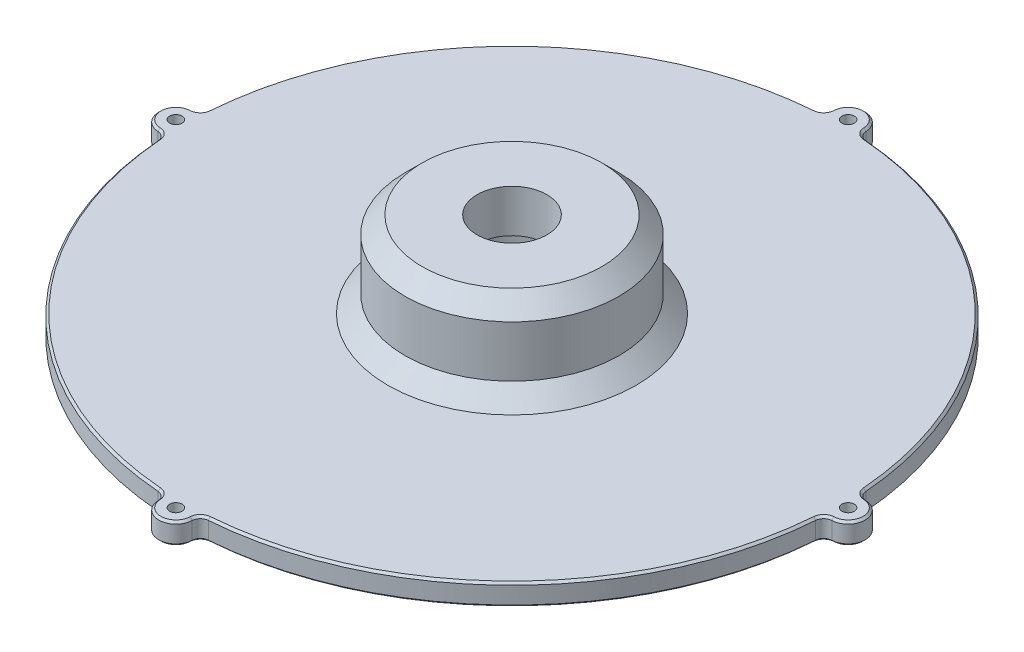
from build123d import *

# Parameters (mm, degrees)
SZKIC2_W                    = 62
SZKIC2_H                    = 5
SZKIC3_R                    = 1.45
DODANIE_WYCI_GNI_CIE1_DEPTH = 5
SFAZOWANIE1_SIZE            = 4
ZAOKR_GLENIE1_R             = 2
SFAZOWANIE2_SIZE            = 0.5


with BuildPart() as part:
    # Szkic2 → Obrót1 (revolve)
    with BuildSketch(Plane.XY, mode=Mode.PRIVATE) as obr_t1_sk:
        Polygon((15, 15), (15, 5), (25, 5), (25, 25), (8.15, 25), (8.15, 15), align=None)
        with Locations((46, 2.5)):
            Rectangle(SZKIC2_W, SZKIC2_H)
    revolve(obr_t1_sk.sketch.rotate(Axis((0, 0, 0), (0, 1, 0)), 90), axis=Axis((0, 0, 0), (0, 1, 0)))

    # Szkic3 → Dodanie-wyciągnięcie1 (add)
    # profile 1 of 4: a face of its own
    with BuildSketch(Plane(origin=(0, 5, 0), x_dir=(1, 0, 0), z_dir=(0, 1, 0))):
        with BuildLine():
            Line((-4, 76), (-4, 78.5))
            ThreePointArc((-4, 78.5), (0, 82.5), (4, 78.5))
            Line((4, 78.5), (4, 76))
            ThreePointArc((4, 76), (0, 72), (-4, 76))
        make_face()
        with Locations(Location((0, 78.5, 0), (0, 0, 270))):
            Circle(SZKIC3_R, mode=Mode.SUBTRACT)
    # profile 2 of 4: a face of its own
    with BuildSketch(Plane(origin=(0, 5, 0), x_dir=(1, 0, 0), z_dir=(0, 1, 0))):
        with BuildLine():
            Line((76, 4), (78.5, 4))
            ThreePointArc((78.5, 4), (82.5, 0), (78.5, -4))
            Line((78.5, -4), (76, -4))
            ThreePointArc((76, -4), (72, 0), (76, 4))
        make_face()
        with Locations(Location((78.5, 0, 0), (0, 0, 270))):
            Circle(SZKIC3_R, mode=Mode.SUBTRACT)
    # profile 3 of 4: a face of its own
    with BuildSketch(Plane(origin=(0, 5, 0), x_dir=(1, 0, 0), z_dir=(0, 1, 0))):
        with BuildLine():
            Line((4, -76), (4, -78.5))
            ThreePointArc((4, -78.5), (0, -82.5), (-4, -78.5))
            Line((-4, -78.5), (-4, -76))
            ThreePointArc((-4, -76), (0, -72), (4, -76))
        make_face()
        with Locations(Location((0, -78.5, 0), (0, 0, 270))):
            Circle(SZKIC3_R, mode=Mode.SUBTRACT)
    # profile 4 of 4: a face of its own
    with BuildSketch(Plane(origin=(0, 5, 0), x_dir=(1, 0, 0), z_dir=(0, 1, 0))):
        with BuildLine():
            Line((-76, -4), (-78.5, -4))
            ThreePointArc((-78.5, -4), (-82.5, 0), (-78.5, 4))
            Line((-78.5, 4), (-76, 4))
            ThreePointArc((-76, 4), (-72, 0), (-76, -4))
        make_face()
        with Locations(Location((-78.5, 0, 0), (0, 0, 270))):
            Circle(SZKIC3_R, mode=Mode.SUBTRACT)
    extrude(amount=-DODANIE_WYCI_GNI_CIE1_DEPTH)

    # Sfazowanie1
    sfazowanie1_edges = [part.edges().sort_by_distance(p)[0] for p in [
        (0, 25, 25),
        (0, 5, 25),
    ]]
    chamfer(sfazowanie1_edges, length=SFAZOWANIE1_SIZE)

    # Zaokrąglenie1
    zaokr_glenie1_edges = [part.edges().sort_by_distance(p)[0] for p in [
        (76.896033708, 2.5, 4),
        (76.896033708, 2.5, -4),
        (4, 2.5, 76.896033708),
        (-4, 2.5, 76.896033708),
        (-76.896033708, 2.5, 4),
        (-76.896033708, 2.5, -4),
        (4, 2.5, -76.896033708),
        (-4, 2.5, -76.896033708),
    ]]
    fillet(zaokr_glenie1_edges, radius=ZAOKR_GLENIE1_R)

    # Sfazowanie2
    sfazowanie2_edges = [part.edges().sort_by_distance(p)[0] for p in [
        (0, 5, -82.5),
        (0, 0, -82.5),
        (77.379843058, 5, 4.55817089),
        (77.379843058, 0, 4.55817089),
        (77.379843058, 5, -4.55817089),
        (77.379843058, 0, -4.55817089),
        (4.55817089, 5, 77.379843058),
        (4.55817089, 0, 77.379843058),
        (-4.55817089, 5, 77.379843058),
        (-4.55817089, 0, 77.379843058),
        (-77.379843058, 5, 4.55817089),
        (-77.379843058, 0, 4.55817089),
        (-77.379843058, 5, -4.55817089),
        (-77.379843058, 0, -4.55817089),
        (4.55817089, 5, -77.379843058),
        (4.55817089, 0, -77.379843058),
        (-4.55817089, 5, -77.379843058),
        (-4.55817089, 0, -77.379843058),
        (-78.5, 0, -1.45),
        (0, 0, 77.05),
        (78.5, 0, -1.45),
        (0, 0, -79.95),
        (0, 0, 15),
        (54.447222151, 5, 54.447222151),
        (54.447222151, 0, 54.447222151),
        (82.5, 5, 0),
        (82.5, 0, 0),
        (54.447222151, 5, -54.447222151),
        (54.447222151, 0, -54.447222151),
        (0, 5, 82.5),
        (0, 0, 82.5),
        (-54.447222151, 5, 54.447222151),
        (-54.447222151, 0, 54.447222151),
        (-82.5, 5, 0),
        (-82.5, 0, 0),
        (-54.447222151, 5, -54.447222151),
        (-54.447222151, 0, -54.447222151),
    ]]
    chamfer(sfazowanie2_edges, length=SFAZOWANIE2_SIZE)


solid = part.part
